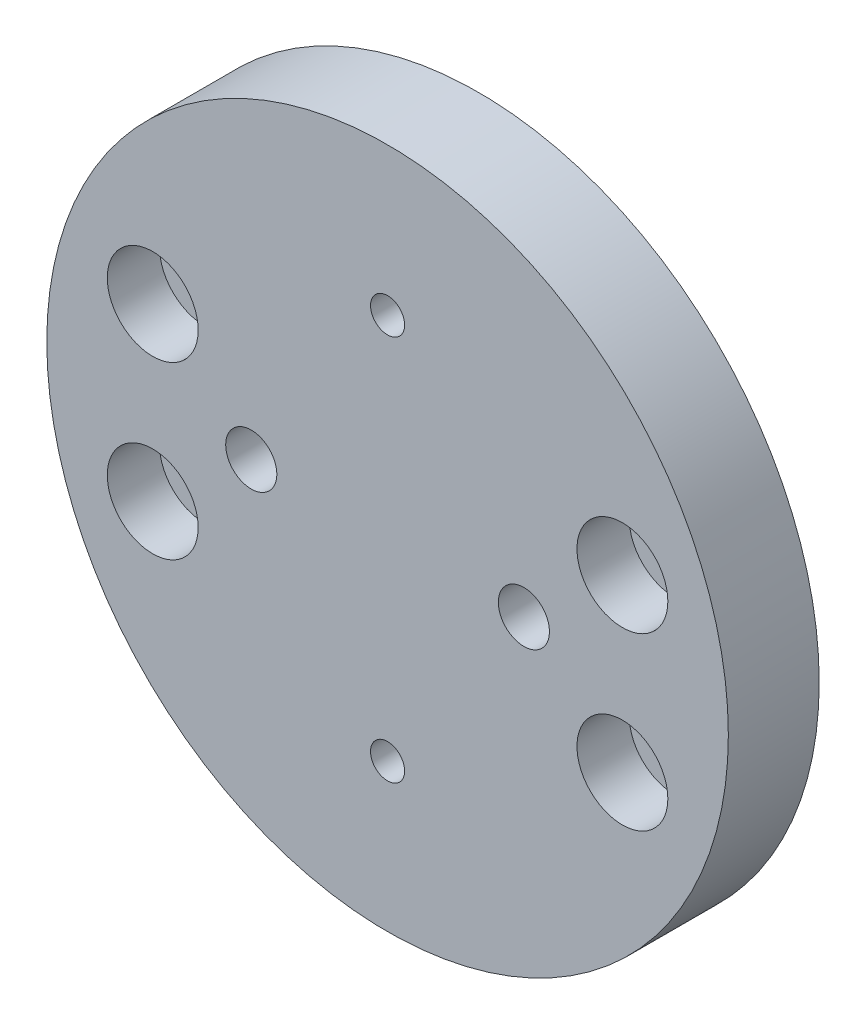
from build123d import *

# Parameters (mm, degrees)
SKETCH_1_R                = 30
EXTRUDE_1_DEPTH           = 8
HOLE_WIZARD_2_AT_2_COUNT  = 2
HOLE_WIZARD_2_AT_2_PITCH  = 24
MM_1_D                    = 3
HOLE_WIZARD_3_D           = 4.5
HOLE_WIZARD_3_CBORE_D     = 8
HOLE_WIZARD_3_CBORE_DEPTH = 4.6


with BuildPart() as part:
    # 草图1 → 凸台-拉伸1 (new body)
    with BuildSketch(Plane.XY):
        Circle(SKETCH_1_R)
    extrude(amount=EXTRUDE_1_DEPTH)

    # 草图10 → 打孔尺寸(%根据)内六角圆柱头螺钉的类型2 (revolve, cut)
    with BuildSketch(Plane.YZ.offset(12)):
        Polygon((0, 0), (0, 8), (2.25, 8), (2.25, 4.6), (4, 4.6), (4, 0.025), (4.025, 0), align=None)
    hole_wizard_2 = revolve(axis=Axis((12, 0, -6.35), (0, 0, 1)), mode=Mode.SUBTRACT)

    # 打孔尺寸(%根据)内六角圆柱头螺钉的类型2 at 2: 打孔尺寸(%根据)内六角圆柱头螺钉的类型2 ×2
    with Locations(*[(-i * HOLE_WIZARD_2_AT_2_PITCH, 0, 0) for i in range(1, HOLE_WIZARD_2_AT_2_COUNT)]):
        add(hole_wizard_2, mode=Mode.SUBTRACT)

    # 大小mm 暗销孔1 (through all)
    with Locations(Plane(origin=(0, 0, 0), x_dir=(-1, 0, 0), z_dir=(0, 0, -1))):
        with Locations((0, -17), (0, 17)):
            Hole(MM_1_D / 2)

    # 打孔尺寸(%根据)内六角圆柱头螺钉的类型3 (through all)
    with Locations(Plane.XY.offset(8)):
        with Locations((-20.673237657, 7.524443153), (-20.673237657, -7.524443153), (20.673237657, 7.524443153), (20.673237657, -7.524443153)):
            CounterBoreHole(HOLE_WIZARD_3_D / 2, HOLE_WIZARD_3_CBORE_D / 2, HOLE_WIZARD_3_CBORE_DEPTH)


solid = part.part
